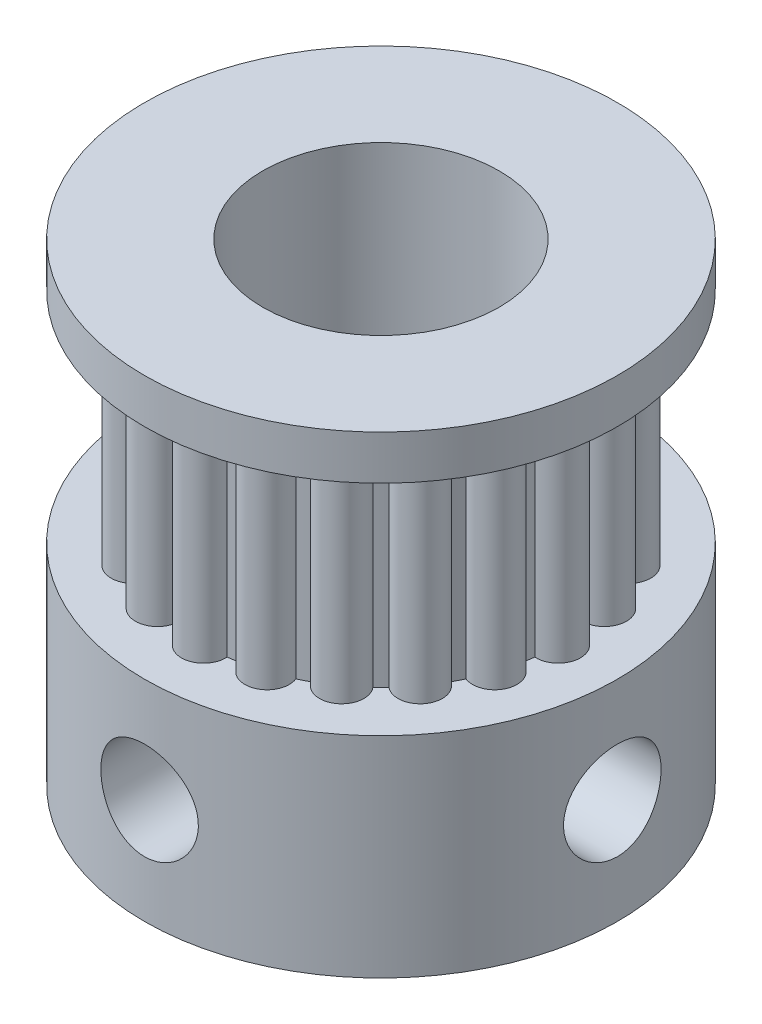
from build123d import *

# Parameters (mm, degrees)
HOLE_WIZARD_M4_1_D               = 3.3
HOLE_WIZARD_M4_1_DEPTH           = 10.1
HOLE_WIZARD_M4_1_TIP             = 0.991420021
HOLE_WIZARD_M4_1_ON_FACE_2_D     = 3.3
HOLE_WIZARD_M4_1_ON_FACE_2_DEPTH = 10.1
HOLE_WIZARD_M4_1_ON_FACE_2_TIP   = 0.991420021
SKETCH_9_R                       = 0.75
EXTRUDE_1_DEPTH                  = 8
PATTERN_CIRCULAR_1_COUNT         = 20


with BuildPart() as part:
    # 草图1 → 旋转1 (revolve)
    with BuildSketch(Plane.XY, mode=Mode.PRIVATE) as revolve_1_sk:
        Polygon((-8, 16), (-4, 16), (-4, 0), (-8, 0), (-8, 7.1), (-6, 7.1), (-6, 14.5), (-8, 14.5), align=None)
    revolve(revolve_1_sk.sketch.rotate(Axis((0, 30.877418673, 0), (0, -1, 0)), 270), axis=Axis((0, 30.877418673, 0), (0, -1, 0)))

    # M4 螺纹孔1
    with Locations(Plane(origin=(0, 3.55, 8), x_dir=(1, 0, 0), z_dir=(0, 0, 1))):
        with Locations((0, 0)):
            Hole(HOLE_WIZARD_M4_1_D / 2, depth=HOLE_WIZARD_M4_1_DEPTH)
            with Locations((0, 0, -(HOLE_WIZARD_M4_1_DEPTH + HOLE_WIZARD_M4_1_TIP / 2))):  # 118° drill point
                Cone(0, HOLE_WIZARD_M4_1_D / 2, HOLE_WIZARD_M4_1_TIP, mode=Mode.SUBTRACT)

    # M4 螺纹孔1 on face 2
    with Locations(Plane(origin=(8, 3.55, 0), x_dir=(0, 0, 1), z_dir=(1, 0, 0))):
        with Locations((0, 0)):
            Hole(HOLE_WIZARD_M4_1_ON_FACE_2_D / 2, depth=HOLE_WIZARD_M4_1_ON_FACE_2_DEPTH)
            with Locations((0, 0, -(HOLE_WIZARD_M4_1_ON_FACE_2_DEPTH + HOLE_WIZARD_M4_1_ON_FACE_2_TIP / 2))):  # 118° drill point
                Cone(0, HOLE_WIZARD_M4_1_ON_FACE_2_D / 2, HOLE_WIZARD_M4_1_ON_FACE_2_TIP, mode=Mode.SUBTRACT)

    # 草图9 → 凸台-拉伸1 (add)
    with BuildSketch(Plane(origin=(0, 7.1, 0), x_dir=(1, 0, 0), z_dir=(0, 1, 0))):
        with Locations((6, 0)):
            Circle(SKETCH_9_R)
    extrude_1 = extrude(amount=EXTRUDE_1_DEPTH)

    # 阵列(圆周)1: 凸台-拉伸1 ×20 about axis
    pattern_circular_1_axis = Axis((0, 0, 0), (0, 1, 0))
    for i in range(1, PATTERN_CIRCULAR_1_COUNT):
        add(extrude_1.rotate(pattern_circular_1_axis, i * 360 / PATTERN_CIRCULAR_1_COUNT))


solid = part.part
